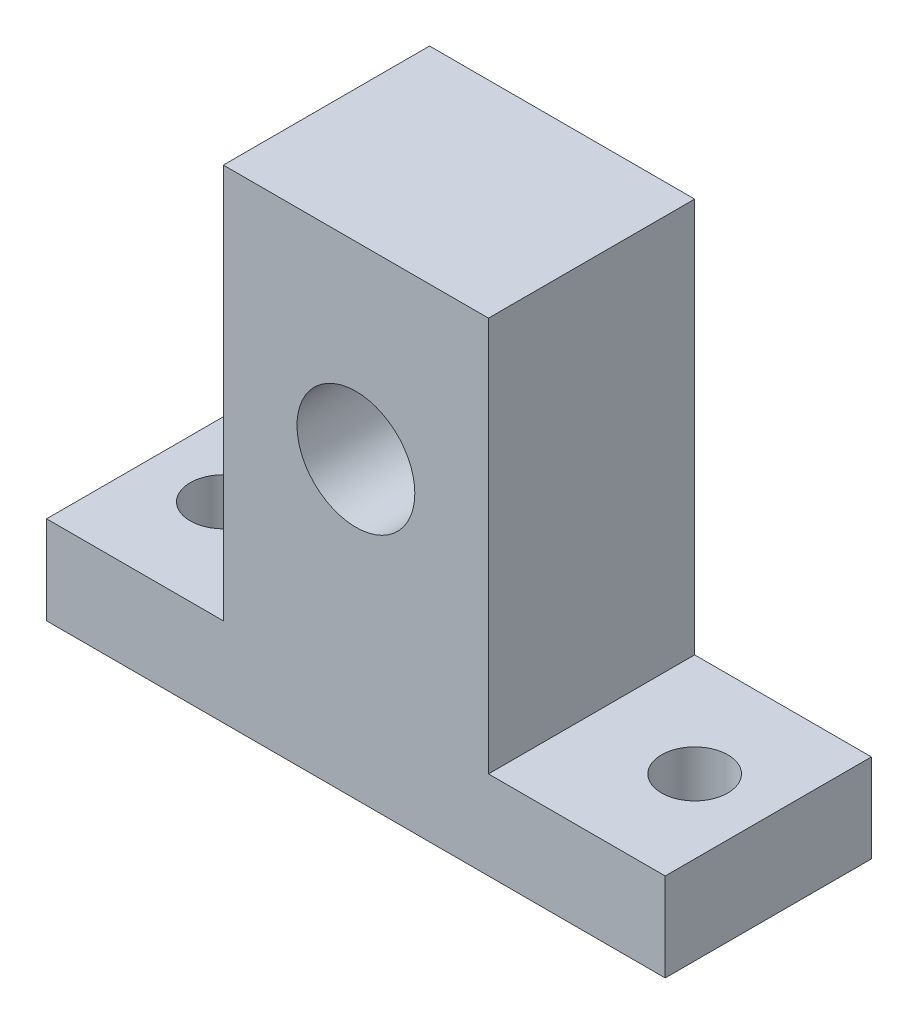
from build123d import *

# Parameters (mm, degrees)
SKETCH_1_R          = 4
EXTRUDE_1_DEPTH     = 14
SKETCH_2_R          = 2.25
CUT_EXTRUDE_1_DEPTH = 37.813584449


with BuildPart() as part:
    # 草图1 → 凸台-拉伸1 (new body)
    with BuildSketch(Plane.XY):
        Polygon((-9, 12.8), (9, 12.8), (9, -14), (21, -14), (21, -20), (-21, -20), (-21, -14), (-9, -14), align=None)
        Circle(SKETCH_1_R, mode=Mode.SUBTRACT)
    extrude(amount=EXTRUDE_1_DEPTH)

    # 草图2 → 切除-拉伸1 (cut, through all)
    with BuildSketch(Plane(origin=(0, -14, 0), x_dir=(1, 0, 0), z_dir=(0, 1, 0))):
        with Locations(Location((-16, -7, 0), (0, 0, 270))):
            Circle(SKETCH_2_R)
        with Locations(Location((16, -7, 0), (0, 0, 270))):
            Circle(SKETCH_2_R)
    extrude(amount=-CUT_EXTRUDE_1_DEPTH, mode=Mode.SUBTRACT)


solid = part.part
